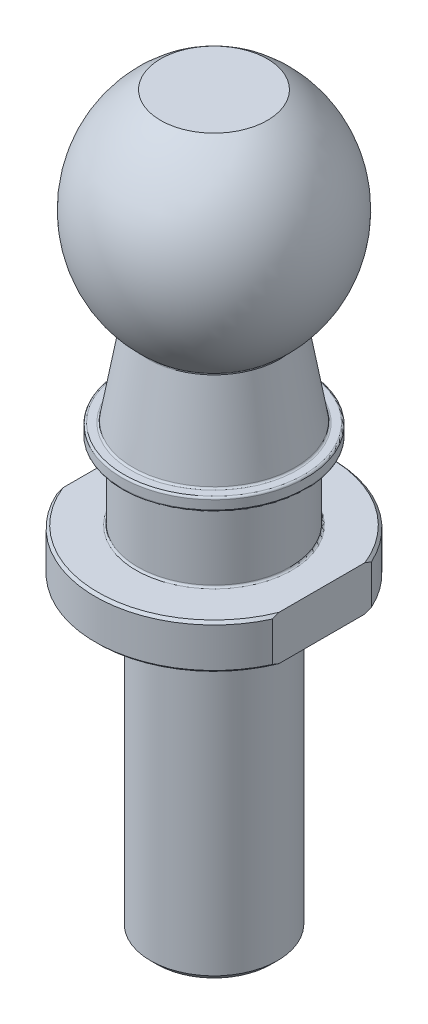
from build123d import *

# Parameters (mm, degrees)
FILETE3_R             = 0.15
CHANFRO1_SIZE         = 0.2
FILETE4_R             = 0.15
CHANFRO2_SIZE         = 0.5
ESBO_O2_W             = 3.197322634
ESBO_O2_H             = 24.687653755
CORTE_EXTRUS_O1_DEPTH = 33.510536845
CORTE_EXTRUS_O2_DEPTH = 5


with BuildPart() as part:
    # Esboço1 → Revolução1 (revolve)
    with BuildSketch(Plane.XY, mode=Mode.PRIVATE) as revolu_o1_sk:
        with BuildLine():
            Line((0, -52.958859358), (5, -52.958859358))
            Line((5, -52.958859358), (5, -28.758859358))
            Line((5, -28.758859358), (9.35, -28.758859358))
            Line((9.35, -28.758859358), (9.35, -25.258859358))
            Line((9.35, -25.258859358), (6, -25.258859358))
            Line((6, -25.258859358), (6, -19.258859358))
            Line((6, -19.258859358), (7.25, -19.258859358))
            Line((7.25, -19.258859358), (7.25, -18.258859358))
            Line((7.25, -18.258859358), (6.4, -18.258859358))
            Line((6.4, -18.258859358), (5.175, -11.258859358))
            ThreePointArc((5.175, -11.258859358), (8.710814676, -3.159668157), (4.202312805, 4.441140642))
            Line((4.202312805, 4.441140642), (0, 4.441140642))
            Line((0, 4.441140642), (0, -52.958859358))
        make_face()
    revolve(revolu_o1_sk.sketch.rotate(Axis((0, 52.480675526, 0), (0, -1, 0)), 90), axis=Axis((0, 52.480675526, 0), (0, -1, 0)))

    # Filete3
    filete3_edges = [part.edges().sort_by_distance(p)[0] for p in [
        (0, -18.258859358, -6.4),
        (0, -18.258859358, -7.25),
        (0, -19.258859358, -7.25),
        (0, -19.258859358, -6),
        (0, -11.258859358, -5.175),
    ]]
    fillet(filete3_edges, radius=FILETE3_R)

    # Chanfro1
    chanfro1_edges = [part.edges().sort_by_distance(p)[0] for p in [
        (0, -25.258859358, -9.35),
        (0, -28.758859358, -9.35),
    ]]
    chamfer(chanfro1_edges, length=CHANFRO1_SIZE)

    # Filete4
    filete4_edges = [part.edges().sort_by_distance(p)[0] for p in [
        (0, -25.258859358, -6),
    ]]
    fillet(filete4_edges, radius=FILETE4_R)

    # Chanfro2
    chanfro2_edges = [part.edges().sort_by_distance(p)[0] for p in [
        (0, -52.958859358, -5),
    ]]
    chamfer(chanfro2_edges, length=CHANFRO2_SIZE)

    # Esboço2 → Corte-extrusão1 (cut, through all)
    with BuildSketch(Plane(origin=(0, -25.258859358, 0), x_dir=(1, 0, 0), z_dir=(0, 1, 0))):
        with Locations((10.098661317, -1.391001442)):
            Rectangle(ESBO_O2_W, ESBO_O2_H)
        with Locations((-10.098661317, -1.391001442)):
            Rectangle(ESBO_O2_W, ESBO_O2_H)
    extrude(amount=-CORTE_EXTRUS_O1_DEPTH, mode=Mode.SUBTRACT)

    # Esboço3 → Corte-extrusão2 (cut)
    with BuildSketch(Plane.XZ.offset(52.958859358)):
        Polygon((2.886751346, 0), (1.443375673, 2.5), (-1.443375673, 2.5), (-2.886751346, 0), (-1.443375673, -2.5), (1.443375673, -2.5), align=None)
    extrude(amount=-CORTE_EXTRUS_O2_DEPTH, mode=Mode.SUBTRACT)


solid = part.part
